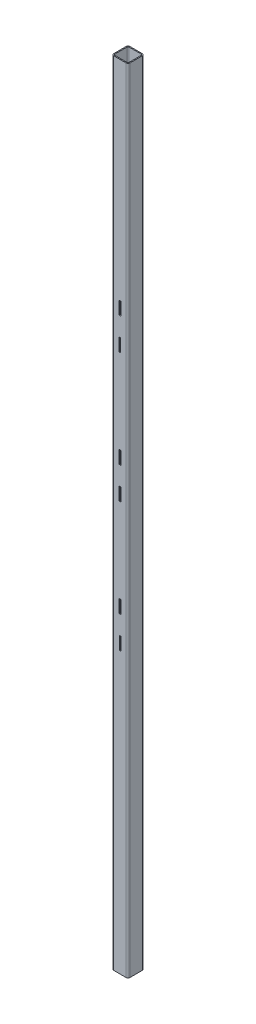
from build123d import *

# Parameters (mm, degrees)
SQUARE_TUBE_CONFIGURED_20_X_20_X_2_1_DEPTH = 1220
CUT_EXTRUDE_1_REACH                        = 1222.32
SKETCH_2_R                                 = 3.75
SKETCH_3_W                                 = 3
SKETCH_3_H                                 = 20
SKETCH_3_W_2                               = 2.5
CUT_EXTRUDE_2_DEPTH                        = 1221.320142422


with BuildPart() as part:
    # Sketch1 → Square tube - configured 20 X 20 X 2(1) (new body)
    with BuildSketch(Plane(origin=(0, 0, 0), x_dir=(-1, 0, 0), z_dir=(0, 1, 0))):
        with BuildLine():
            Line((-9.5, -12.5), (9.5, -12.5))
            ThreePointArc((9.5, -12.5), (11.621320344, -11.621320344), (12.5, -9.5))
            Line((12.5, -9.5), (12.5, 9.5))
            ThreePointArc((12.5, 9.5), (11.621320344, 11.621320344), (9.5, 12.5))
            Line((9.5, 12.5), (-9.5, 12.5))
            ThreePointArc((-9.5, 12.5), (-11.621320344, 11.621320344), (-12.5, 9.5))
            Line((-12.5, 9.5), (-12.5, -9.5))
            ThreePointArc((-12.5, -9.5), (-11.621320344, -11.621320344), (-9.5, -12.5))
        make_face()
        with BuildLine():
            Line((-9.5, -11), (9.5, -11))
            ThreePointArc((9.5, -11), (10.560660172, -10.560660172), (11, -9.5))
            Line((11, -9.5), (11, 9.5))
            ThreePointArc((11, 9.5), (10.560660172, 10.560660172), (9.5, 11))
            Line((9.5, 11), (-9.5, 11))
            ThreePointArc((-9.5, 11), (-10.560660172, 10.560660172), (-11, 9.5))
            Line((-11, 9.5), (-11, -9.5))
            ThreePointArc((-11, -9.5), (-10.560660172, -10.560660172), (-9.5, -11))
        make_face(mode=Mode.SUBTRACT)
    extrude(amount=SQUARE_TUBE_CONFIGURED_20_X_20_X_2_1_DEPTH)

    # Эскиз2 → Вырез-Вытянуть1 (cut, up to next)
    with BuildSketch(Plane.ZY.offset(12.5), mode=Mode.PRIVATE) as cut_extrude_1_sk1:
        with Locations((0, 17)):
            Circle(SKETCH_2_R)
    cut_extrude_1_tool1 = extrude(cut_extrude_1_sk1.sketch, amount=-CUT_EXTRUDE_1_REACH, mode=Mode.PRIVATE) & part.part
    # Эскиз2 → Вырез-Вытянуть1 (cut, up to next)
    with BuildSketch(Plane.ZY.offset(12.5), mode=Mode.PRIVATE) as cut_extrude_1_sk2:
        with Locations((0, 47)):
            Circle(SKETCH_2_R)
    cut_extrude_1_tool2 = extrude(cut_extrude_1_sk2.sketch, amount=-CUT_EXTRUDE_1_REACH, mode=Mode.PRIVATE) & part.part
    cut_extrude_1_1 = cut_extrude_1_tool1.solids().sort_by_distance((-12.5, 17, 0))[0]
    add(cut_extrude_1_1, mode=Mode.SUBTRACT)
    cut_extrude_1_2 = cut_extrude_1_tool2.solids().sort_by_distance((-12.5, 47, 0))[0]
    add(cut_extrude_1_2, mode=Mode.SUBTRACT)
    cut_extrude_1 = cut_extrude_1_1 + cut_extrude_1_2  # Вырез-Вытянуть1 as one shape, for the pattern or mirror that repeats it

    # Зеркальное отражение1: Вырез-Вытянуть1 across plane
    add(cut_extrude_1.mirror(Plane.ZX.offset(610)), mode=Mode.SUBTRACT)

    # Эскиз3 → Вырез-Вытянуть2 (cut, through all)
    with BuildSketch(Plane.XY.offset(12.5)):
        with Locations((0, 888.220627209)):
            Rectangle(SKETCH_3_W, SKETCH_3_H)
        with Locations((0, 839.220627209)):
            Rectangle(SKETCH_3_W_2, SKETCH_3_H)
        with Locations((0.25, 689.264040992)):
            Rectangle(SKETCH_3_W, SKETCH_3_H)
        with Locations((0.25, 640.264040992)):
            Rectangle(SKETCH_3_W_2, SKETCH_3_H)
        with Locations((0.5, 490.307454775)):
            Rectangle(SKETCH_3_W, SKETCH_3_H)
        with Locations((0.5, 441.307454775)):
            Rectangle(SKETCH_3_W_2, SKETCH_3_H)
    extrude(amount=-CUT_EXTRUDE_2_DEPTH, mode=Mode.SUBTRACT)


solid = part.part
